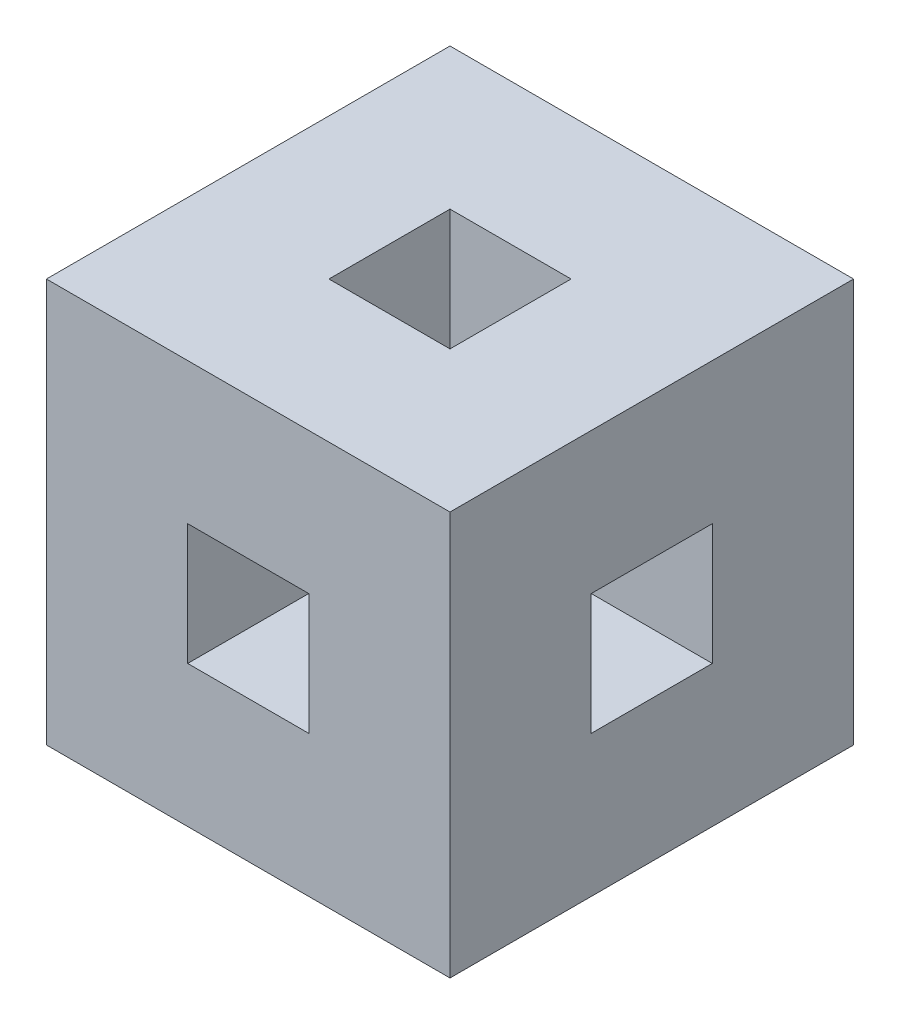
from build123d import *

# Parameters (mm, degrees)
SKETCH2_W           = 50
SKETCH2_H           = 50
BOSS_EXTRUDE1_DEPTH = 50
SKETCH4_W           = 15
SKETCH4_H           = 15
CUT_EXTRUDE1_DEPTH  = 76
SKETCH5_W           = 15
SKETCH5_H           = 15
CUT_EXTRUDE2_DEPTH  = 76
SKETCH6_W           = 15
SKETCH6_H           = 15
CUT_EXTRUDE3_DEPTH  = 62.23724357


with BuildPart() as part:
    # Sketch2 → Boss-Extrude1 (new body)
    with BuildSketch(Plane(origin=(0, 0, 0), x_dir=(1, 0, 0), z_dir=(0, 1, 0))):
        Rectangle(SKETCH2_W, SKETCH2_H)
    extrude(amount=BOSS_EXTRUDE1_DEPTH)

    # Sketch4 → Cut-Extrude1 (cut, through all)
    with BuildSketch(Plane.XY.offset(25)):
        with Locations((0, 25)):
            Rectangle(SKETCH4_W, SKETCH4_H)
    extrude(amount=-CUT_EXTRUDE1_DEPTH, mode=Mode.SUBTRACT)

    # Sketch5 → Cut-Extrude2 (cut, through all)
    with BuildSketch(Plane(origin=(25, 0, 0), x_dir=(0, 0, -1), z_dir=(1, 0, 0))):
        with Locations((0, 25)):
            Rectangle(SKETCH5_W, SKETCH5_H)
    extrude(amount=-CUT_EXTRUDE2_DEPTH, mode=Mode.SUBTRACT)

    # Sketch6 → Cut-Extrude3 (cut, through all)
    with BuildSketch(Plane(origin=(0, 50, 0), x_dir=(1, 0, 0), z_dir=(0, 1, 0))):
        Rectangle(SKETCH6_W, SKETCH6_H)
    extrude(amount=-CUT_EXTRUDE3_DEPTH, mode=Mode.SUBTRACT)


solid = part.part
